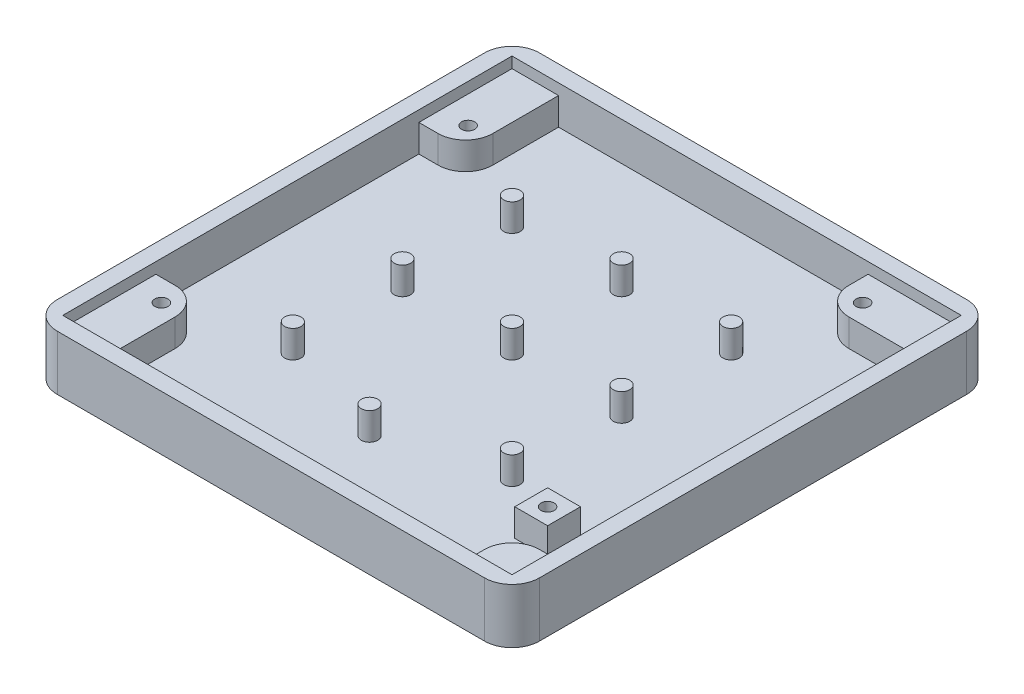
from build123d import *

# Parameters (mm, degrees)
SKETCH_1_W      = 88
SKETCH_1_H      = 88
EXTRUDE_1_DEPTH = 3
SKETCH_2_W      = 88
SKETCH_2_H      = 88
SKETCH_2_W_2    = 82
SKETCH_2_H_2    = 82
EXTRUDE_2_DEPTH = 7
SKETCH_3_R      = 1.5
SKETCH_3_W      = 8.5
SKETCH_3_H      = 17
SKETCH_3_R_2    = 1.2
SKETCH_3_W_2    = 17
SKETCH_3_H_2    = 8.5
SKETCH_3_W_3    = 6
SKETCH_3_H_3    = 6
EXTRUDE_3_DEPTH = 5
FILLET_1_R      = 5


with BuildPart() as part:
    # 草圖1 → 填料-伸長1 (new body)
    with BuildSketch(Plane(origin=(0, 0, 0), x_dir=(1, 0, 0), z_dir=(0, 1, 0))):
        with Locations((7.62917335, -5.98816568)):
            Rectangle(SKETCH_1_W, SKETCH_1_H)
    extrude(amount=EXTRUDE_1_DEPTH)

    # 草圖2 → 填料-伸長2 (add)
    with BuildSketch(Plane(origin=(0, 3, 0), x_dir=(1, 0, 0), z_dir=(0, 1, 0))):
        with Locations((7.62917335, -5.98816568)):
            Rectangle(SKETCH_2_W, SKETCH_2_H)
        with Locations((7.62917335, -5.98816568)):
            Rectangle(SKETCH_2_W_2, SKETCH_2_H_2, mode=Mode.SUBTRACT)
    extrude(amount=EXTRUDE_2_DEPTH)

    # 草圖3 → 填料-伸長3 (add)
    # profile 1 of 14: a face of its own
    with BuildSketch(Plane(origin=(0, 3, 0), x_dir=(1, 0, 0), z_dir=(0, 1, 0))):
        with Locations(Location((-13.37082665, 15.01183432, 0), (0, 0, 270))):
            Circle(SKETCH_3_R)
    # profile 2 of 14: a face of its own
    with BuildSketch(Plane(origin=(0, 3, 0), x_dir=(1, 0, 0), z_dir=(0, 1, 0))):
        with Locations(Location((6.62917335, 15.01183432, 0), (0, 0, 270))):
            Circle(SKETCH_3_R)
    # profile 3 of 14: a face of its own
    with BuildSketch(Plane(origin=(0, 3, 0), x_dir=(1, 0, 0), z_dir=(0, 1, 0))):
        with Locations(Location((26.62917335, 15.01183432, 0), (0, 0, 270))):
            Circle(SKETCH_3_R)
    # profile 4 of 14: a face of its own
    with BuildSketch(Plane(origin=(0, 3, 0), x_dir=(1, 0, 0), z_dir=(0, 1, 0))):
        with Locations(Location((6.62917335, -4.98816568, 0), (0, 0, 270))):
            Circle(SKETCH_3_R)
    # profile 5 of 14: a face of its own
    with BuildSketch(Plane(origin=(0, 3, 0), x_dir=(1, 0, 0), z_dir=(0, 1, 0))):
        with Locations(Location((26.62917335, -4.98816568, 0), (0, 0, 270))):
            Circle(SKETCH_3_R)
    # profile 6 of 14: a face of its own
    with BuildSketch(Plane(origin=(0, 3, 0), x_dir=(1, 0, 0), z_dir=(0, 1, 0))):
        with Locations(Location((26.62917335, -24.98816568, 0), (0, 0, 270))):
            Circle(SKETCH_3_R)
    # profile 7 of 14: a face of its own
    with BuildSketch(Plane(origin=(0, 3, 0), x_dir=(1, 0, 0), z_dir=(0, 1, 0))):
        with Locations(Location((-13.37082665, -4.98816568, 0), (0, 0, 270))):
            Circle(SKETCH_3_R)
    # profile 8 of 14: a face of its own
    with BuildSketch(Plane(origin=(0, 3, 0), x_dir=(1, 0, 0), z_dir=(0, 1, 0))):
        with Locations(Location((-13.37082665, -24.98816568, 0), (0, 0, 270))):
            Circle(SKETCH_3_R)
    # profile 9 of 14: a face of its own
    with BuildSketch(Plane(origin=(0, 3, 0), x_dir=(1, 0, 0), z_dir=(0, 1, 0))):
        with Locations(Location((6.62917335, -30.98816568, 0), (0, 0, 270))):
            Circle(SKETCH_3_R)
    # profile 10 of 14: a face of its own
    with BuildSketch(Plane(origin=(0, 3, 0), x_dir=(1, 0, 0), z_dir=(0, 1, 0))):
        with Locations((-29.12082665, 26.51183432)):
            Rectangle(SKETCH_3_W, SKETCH_3_H)
        with Locations(Location((-28.37082665, 22.01183432, 0), (0, 0, 270))):
            Circle(SKETCH_3_R_2, mode=Mode.SUBTRACT)
    # profile 11 of 14: a face of its own
    with BuildSketch(Plane(origin=(0, 3, 0), x_dir=(1, 0, 0), z_dir=(0, 1, 0))):
        with Locations((-29.12082665, -38.48816568)):
            Rectangle(SKETCH_3_W, SKETCH_3_H)
        with Locations(Location((-28.37082665, -33.98816568, 0), (0, 0, 270))):
            Circle(SKETCH_3_R_2, mode=Mode.SUBTRACT)
    # profile 12 of 14: a face of its own
    with BuildSketch(Plane(origin=(0, 3, 0), x_dir=(1, 0, 0), z_dir=(0, 1, 0))):
        with Locations((40.12917335, 30.76183432)):
            Rectangle(SKETCH_3_W_2, SKETCH_3_H_2)
        with Locations(Location((35.62917335, 30.01183432, 0), (0, 0, 270))):
            Circle(SKETCH_3_R_2, mode=Mode.SUBTRACT)
    # profile 13 of 14: a face of its own
    with BuildSketch(Plane(origin=(0, 3, 0), x_dir=(1, 0, 0), z_dir=(0, 1, 0))):
        with Locations((44.37917335, -42.73816568)):
            Rectangle(SKETCH_3_W, SKETCH_3_H_2)
    # profile 14 of 14: a face of its own
    with BuildSketch(Plane(origin=(0, 3, 0), x_dir=(1, 0, 0), z_dir=(0, 1, 0))):
        with Locations((39.12917335, -30.98816568)):
            Rectangle(SKETCH_3_W_3, SKETCH_3_H_3)
        with Locations(Location((39.12917335, -30.98816568, 0), (0, 0, 270))):
            Circle(SKETCH_3_R_2, mode=Mode.SUBTRACT)
    extrude(amount=EXTRUDE_3_DEPTH)

    # 圓角1
    fillet_1_edges = [part.edges().sort_by_distance(p)[0] for p in [
        (-24.87082665, 5.5, -18.01183432),
        (-24.87082665, 5.5, 29.98816568),
        (31.62917335, 5.5, -26.51183432),
        (-36.37082665, 5, -38.01183432),
        (51.62917335, 5, -38.01183432),
        (51.62917335, 5, 49.98816568),
        (-36.37082665, 5, 49.98816568),
        (40.12917335, 5.5, 38.48816568),
    ]]
    fillet(fillet_1_edges, radius=FILLET_1_R)


solid = part.part
